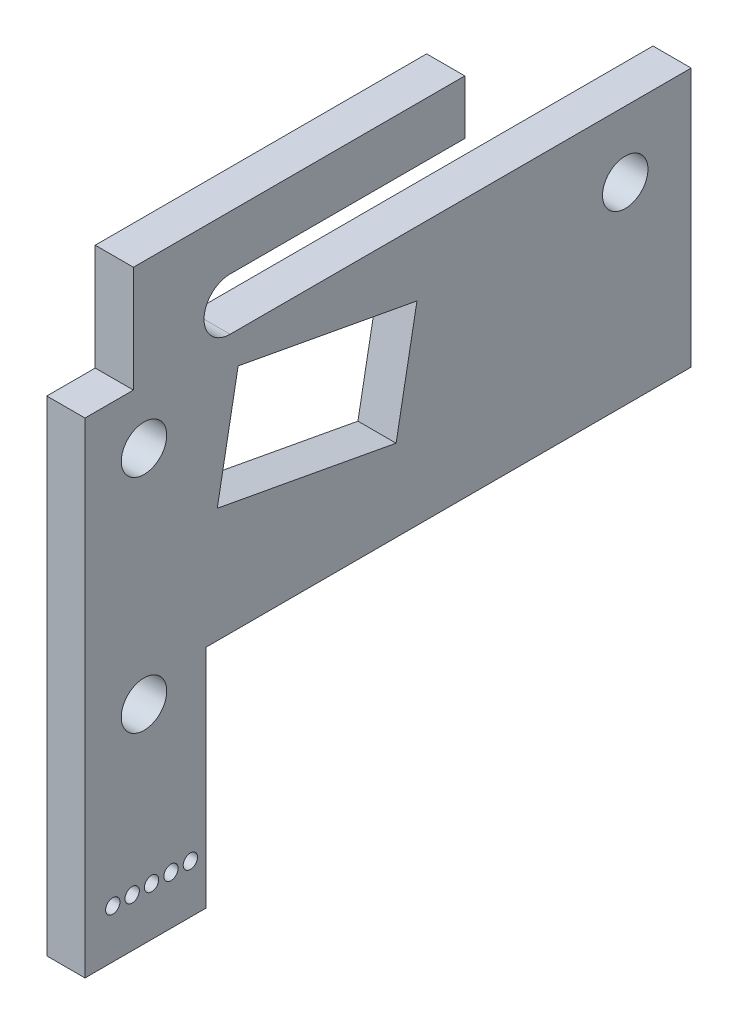
from build123d import *

# Parameters (mm, degrees)
SKETCH1_R           = 2.38125
SKETCH1_R_2         = 0.75
BOSS_EXTRUDE1_DEPTH = 2


with BuildPart() as part:
    # Sketch1 → Boss-Extrude1 (new, symmetric)
    with BuildSketch(Plane(origin=(0, 0, 0), x_dir=(0, 0, -1), z_dir=(1, 0, 0))):
        with BuildLine():
            Line((-56.590412722, 6.909587278), (-51.518608779, 6.909587278))
            Line((-51.518608779, 6.909587278), (-51.518608779, 18.053715602))
            Line((-51.518608779, 18.053715602), (-16.803992093, 18.053715602))
            Line((-16.803992093, 18.053715602), (-16.803992093, 12.37380655))
            Line((-16.803992093, 12.37380655), (-41.3883309, 12.37380655))
            ThreePointArc((-41.3883309, 12.37380655), (-44.120440536, 9.641696914), (-41.3883309, 6.909587278))
            Line((-41.3883309, 6.909587278), (6.909587278, 6.909587278))
            Line((6.909587278, 6.909587278), (6.909587278, -20.222057583))
            Line((6.909587278, -20.222057583), (-43.890412722, -20.222057583))
            Line((-43.890412722, -20.222057583), (-43.890412722, -43.890412722))
            Line((-43.890412722, -43.890412722), (-56.590412722, -43.890412722))
            Line((-56.590412722, -43.890412722), (-56.590412722, 6.909587278))
        make_face()
        Circle(SKETCH1_R, mode=Mode.SUBTRACT)
        with Locations((-45.552958224, -38.810412722)):
            Circle(SKETCH1_R_2, mode=Mode.SUBTRACT)
        with Locations((-47.584958224, -38.810412722)):
            Circle(SKETCH1_R_2, mode=Mode.SUBTRACT)
        with Locations((-49.616958224, -38.810412722)):
            Circle(SKETCH1_R_2, mode=Mode.SUBTRACT)
        with Locations((-51.648958224, -38.810412722)):
            Circle(SKETCH1_R_2, mode=Mode.SUBTRACT)
        with Locations((-50.410128911, -22.137211246)):
            Circle(SKETCH1_R, mode=Mode.SUBTRACT)
        with Locations((-50.410128911, 1.079375692)):
            Circle(SKETCH1_R, mode=Mode.SUBTRACT)
        with Locations((-53.680958224, -38.810412722)):
            Circle(SKETCH1_R_2, mode=Mode.SUBTRACT)
        Polygon((-40.547855017, 3.612408172), (-21.81561352, 0.147494252), (-24.001169646, -11.668200482), (-42.733411143, -8.203286562), align=None, mode=Mode.SUBTRACT)
    extrude(amount=BOSS_EXTRUDE1_DEPTH, both=True)


solid = part.part
